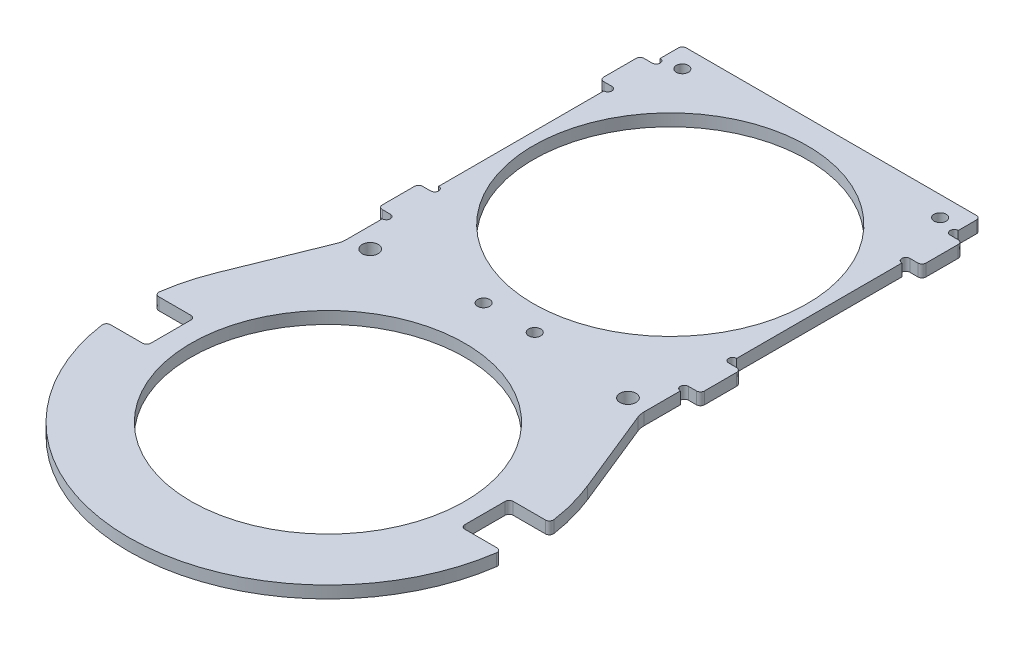
from build123d import *

# Parameters (mm, degrees)
SKETCH_1_R          = 1.5
SKETCH_1_R_2        = 34
SKETCH_1_R_3        = 2
EXTRUDE_1_DEPTH     = 3
CUT_EXTRUDE_1_DEPTH = 135.477693318
SKETCH_8_R          = 1
CUT_EXTRUDE_3_DEPTH = 135.343775442
FILLET_1_R          = 1
FILLET_2_R          = 5


with BuildPart() as part:
    # 草图1 → Extrude 1 (new body)
    with BuildSketch(Plane(origin=(0, 0, 0), x_dir=(1, 0, 0), z_dir=(0, 1, 0))):
        with BuildLine():
            Line((-37, 40.5), (-37, 52.5))
            Line((-37, 52.5), (-40, 52.5))
            Line((-40, 52.5), (-40, 62.5))
            Line((-40, 62.5), (-37, 62.5))
            Line((-37, 62.5), (-37, 107.5))
            Line((-37, 107.5), (-40, 107.5))
            Line((-40, 107.5), (-40, 117.5))
            Line((-40, 117.5), (-37, 117.5))
            Line((-37, 117.5), (-37, 125))
            Line((-37, 125), (37, 125))
            Line((37, 125), (37, 117.5))
            Line((37, 117.5), (40, 117.5))
            Line((40, 117.5), (40, 107.5))
            Line((40, 107.5), (37, 107.5))
            Line((37, 107.5), (37, 62.5))
            Line((37, 62.5), (40, 62.5))
            Line((40, 62.5), (40, 52.5))
            Line((40, 52.5), (37, 52.5))
            Line((37, 52.5), (37, 40.5))
            Line((37, 40.5), (45.877848892, 18.586903481))
            ThreePointArc((45.877848892, 18.586903481), (0, -49.5), (-45.877848892, 18.586903481))
            Line((-45.877848892, 18.586903481), (-37, 40.5))
        make_face()
        with Locations(Location((-6.35, 45, 0), (0, 0, 270))):
            Circle(SKETCH_1_R, mode=Mode.SUBTRACT)
        with Locations(Location((6.35, 45, 0), (0, 0, 270))):
            Circle(SKETCH_1_R, mode=Mode.SUBTRACT)
        with Locations(Location((0, 85, 0), (0, 0, 270))):
            Circle(SKETCH_1_R_2, mode=Mode.SUBTRACT)
        with Locations(Location((0, 0, 0), (0, 0, 270))):
            Circle(SKETCH_1_R_2, mode=Mode.SUBTRACT)
        with Locations(Location((-32, 120, 0), (0, 0, 270))):
            Circle(SKETCH_1_R, mode=Mode.SUBTRACT)
        with Locations(Location((-32, 42.5, 0), (0, 0, 270))):
            Circle(SKETCH_1_R_3, mode=Mode.SUBTRACT)
        with Locations(Location((32, 42.5, 0), (0, 0, 90))):
            Circle(SKETCH_1_R_3, mode=Mode.SUBTRACT)
        with Locations(Location((32, 120, 0), (0, 0, 90))):
            Circle(SKETCH_1_R, mode=Mode.SUBTRACT)
    extrude(amount=EXTRUDE_1_DEPTH)

    # 草图2 → 切除-拉伸1 (cut, through all)
    with BuildSketch(Plane(origin=(0, 3, 0), x_dir=(1, 0, 0), z_dir=(0, 1, 0))):
        with BuildLine():
            Line((-49.135018062, 6), (-39, 6))
            Line((-39, 6), (-39, -6))
            Line((-39, -6), (-49.135018062, -6))
            ThreePointArc((-49.135018062, -6), (-49.5, 0), (-49.135018062, 6))
        make_face()
        with BuildLine():
            Line((49.135018062, 6), (39, 6))
            Line((39, 6), (39, -6))
            Line((39, -6), (49.135018062, -6))
            ThreePointArc((49.135018062, -6), (49.5, 0), (49.135018062, 6))
        make_face()
    extrude(amount=-CUT_EXTRUDE_1_DEPTH, mode=Mode.SUBTRACT)

    # 草图8 → 切除-拉伸3 (cut, through all)
    with BuildSketch(Plane(origin=(0, 3, 0), x_dir=(1, 0, 0), z_dir=(0, 1, 0))):
        with Locations((-37, 118.5)):
            Circle(SKETCH_8_R)
        with Locations((-37, 106.5)):
            Circle(SKETCH_8_R)
        with Locations((-37, 63.5)):
            Circle(SKETCH_8_R)
        with Locations((-37, 51.5)):
            Circle(SKETCH_8_R)
        with Locations((37, 51.5)):
            Circle(SKETCH_8_R)
        with Locations((37, 63.5)):
            Circle(SKETCH_8_R)
        with Locations((37, 106.5)):
            Circle(SKETCH_8_R)
        with Locations((37, 118.5)):
            Circle(SKETCH_8_R)
    extrude(amount=-CUT_EXTRUDE_3_DEPTH, mode=Mode.SUBTRACT)

    # 圆角1
    fillet_1_edges = [part.edges().sort_by_distance(p)[0] for p in [
        (-49.135018062, 1.5, 6),
        (-49.135018062, 1.5, -6),
        (-39, 1.5, -6),
        (-39, 1.5, 6),
        (49.135018062, 1.5, -6),
        (49.135018062, 1.5, 6),
        (39, 1.5, 6),
        (39, 1.5, -6),
        (-40, 1.5, -107.5),
        (-40, 1.5, -117.5),
        (-37, 1.5, -125),
        (37, 1.5, -125),
        (40, 1.5, -117.5),
        (40, 1.5, -107.5),
        (40, 1.5, -62.5),
        (40, 1.5, -52.5),
        (-40, 1.5, -52.5),
        (-40, 1.5, -62.5),
    ]]
    fillet(fillet_1_edges, radius=FILLET_1_R)

    # 圆角2
    fillet_2_edges = [part.edges().sort_by_distance(p)[0] for p in [
        (37, 1.5, -40.5),
        (-37, 1.5, -40.5),
    ]]
    fillet(fillet_2_edges, radius=FILLET_2_R)


solid = part.part
